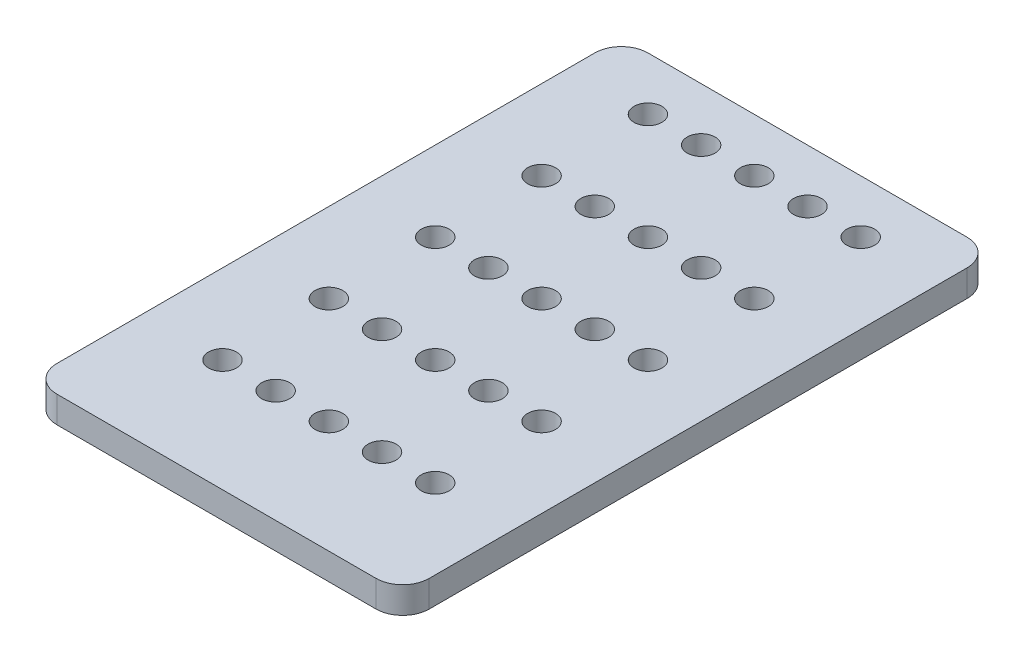
from build123d import *

# Parameters (mm, degrees)
SKETCH1_W           = 56
SKETCH1_H           = 88.9
SKETCH1_R           = 2.1
BOSS_EXTRUDE1_DEPTH = 4
FILLET1_R           = 4


with BuildPart() as part:
    # Sketch1 → Boss-Extrude1 (new body)
    with BuildSketch(Plane(origin=(0, 0, 0), x_dir=(1, 0, 0), z_dir=(0, 1, 0))):
        with Locations((0, -36.45)):
            Rectangle(SKETCH1_W, SKETCH1_H)
        with Locations(Location((-16, 0, 0), (0, 0, 270))):
            Circle(SKETCH1_R, mode=Mode.SUBTRACT)
        with Locations(Location((16, 0, 0), (0, 0, 270))):
            Circle(SKETCH1_R, mode=Mode.SUBTRACT)
        with Locations(Location((-8, 0, 0), (0, 0, 270))):
            Circle(SKETCH1_R, mode=Mode.SUBTRACT)
        with Locations(Location((0, 0, 0), (0, 0, 270))):
            Circle(SKETCH1_R, mode=Mode.SUBTRACT)
        with Locations(Location((8, 0, 0), (0, 0, 270))):
            Circle(SKETCH1_R, mode=Mode.SUBTRACT)
        with Locations(Location((-16, -16, 0), (0, 0, 270))):
            Circle(SKETCH1_R, mode=Mode.SUBTRACT)
        with Locations(Location((-8, -16, 0), (0, 0, 270))):
            Circle(SKETCH1_R, mode=Mode.SUBTRACT)
        with Locations(Location((0, -16, 0), (0, 0, 270))):
            Circle(SKETCH1_R, mode=Mode.SUBTRACT)
        with Locations(Location((8, -16, 0), (0, 0, 270))):
            Circle(SKETCH1_R, mode=Mode.SUBTRACT)
        with Locations(Location((16, -16, 0), (0, 0, 270))):
            Circle(SKETCH1_R, mode=Mode.SUBTRACT)
        with Locations(Location((-16, -32, 0), (0, 0, 270))):
            Circle(SKETCH1_R, mode=Mode.SUBTRACT)
        with Locations(Location((-8, -32, 0), (0, 0, 270))):
            Circle(SKETCH1_R, mode=Mode.SUBTRACT)
        with Locations(Location((0, -32, 0), (0, 0, 270))):
            Circle(SKETCH1_R, mode=Mode.SUBTRACT)
        with Locations(Location((8, -32, 0), (0, 0, 270))):
            Circle(SKETCH1_R, mode=Mode.SUBTRACT)
        with Locations(Location((16, -32, 0), (0, 0, 270))):
            Circle(SKETCH1_R, mode=Mode.SUBTRACT)
        with Locations(Location((-16, -48, 0), (0, 0, 270))):
            Circle(SKETCH1_R, mode=Mode.SUBTRACT)
        with Locations(Location((-8, -48, 0), (0, 0, 270))):
            Circle(SKETCH1_R, mode=Mode.SUBTRACT)
        with Locations(Location((0, -48, 0), (0, 0, 270))):
            Circle(SKETCH1_R, mode=Mode.SUBTRACT)
        with Locations(Location((8, -48, 0), (0, 0, 270))):
            Circle(SKETCH1_R, mode=Mode.SUBTRACT)
        with Locations(Location((16, -48, 0), (0, 0, 270))):
            Circle(SKETCH1_R, mode=Mode.SUBTRACT)
        with Locations(Location((-16, -64, 0), (0, 0, 270))):
            Circle(SKETCH1_R, mode=Mode.SUBTRACT)
        with Locations(Location((-8, -64, 0), (0, 0, 270))):
            Circle(SKETCH1_R, mode=Mode.SUBTRACT)
        with Locations(Location((0, -64, 0), (0, 0, 270))):
            Circle(SKETCH1_R, mode=Mode.SUBTRACT)
        with Locations(Location((8, -64, 0), (0, 0, 270))):
            Circle(SKETCH1_R, mode=Mode.SUBTRACT)
        with Locations(Location((16, -64, 0), (0, 0, 270))):
            Circle(SKETCH1_R, mode=Mode.SUBTRACT)
    extrude(amount=BOSS_EXTRUDE1_DEPTH)

    # Fillet1
    fillet1_edges = [part.edges().sort_by_distance(p)[0] for p in [
        (-28, 2, -8),
        (28, 2, -8),
        (28, 2, 80.9),
        (-28, 2, 80.9),
    ]]
    fillet(fillet1_edges, radius=FILLET1_R)


solid = part.part
